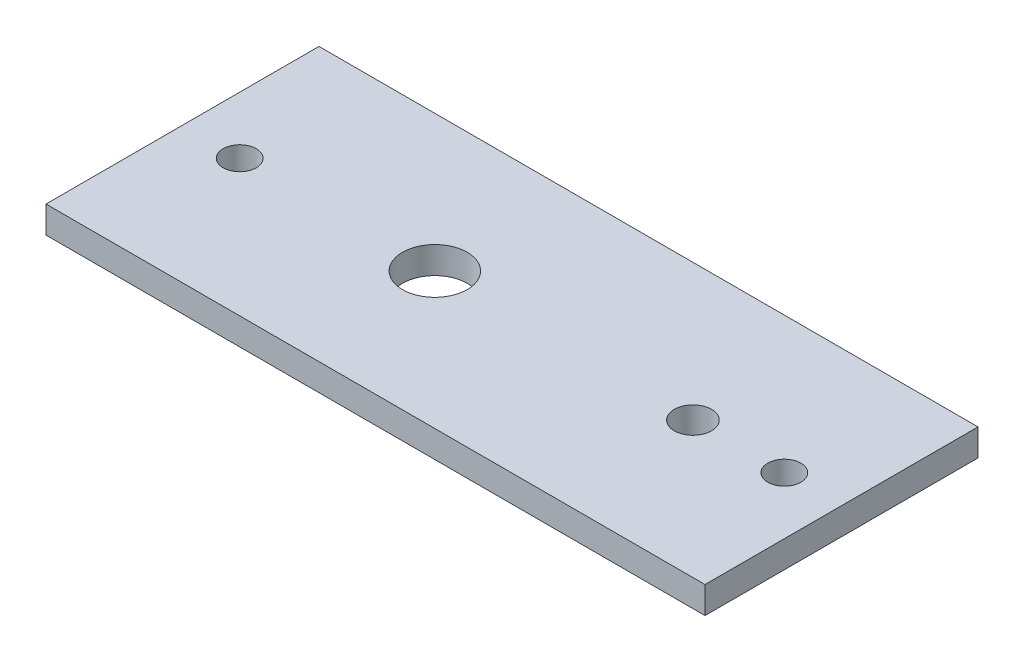
from build123d import *

# Parameters (mm, degrees)
SKETCH1_W           = 80.830931362
SKETCH1_H           = 33.48304161
SKETCH1_R           = 2.032
BOSS_EXTRUDE1_DEPTH = 3.302
SKETCH2_R           = 3.96875
SKETCH2_R_2         = 2.286
CUT_EXTRUDE1_DEPTH  = 3.302


with BuildPart() as part:
    # Sketch1 → Boss-Extrude1 (new body)
    with BuildSketch(Plane(origin=(0, 0, 0), x_dir=(1, 0, 0), z_dir=(0, 1, 0))):
        Rectangle(SKETCH1_W, SKETCH1_H)
        with Locations(Location((-33.401, 0, 0), (0, 0, 90))):
            Circle(SKETCH1_R, mode=Mode.SUBTRACT)
        with Locations(Location((33.401, 0, 0), (0, 0, 90))):
            Circle(SKETCH1_R, mode=Mode.SUBTRACT)
    extrude(amount=BOSS_EXTRUDE1_DEPTH)

    # Sketch2 → Cut-Extrude1 (cut)
    with BuildSketch(Plane.XZ):
        with Locations(Location((-9.4615, 0, 0), (0, 0, 270))):
            Circle(SKETCH2_R)
        with Locations(Location((22.209125, 0.016190079, 0), (0, 0, 270))):
            Circle(SKETCH2_R_2)
    extrude(amount=-CUT_EXTRUDE1_DEPTH, mode=Mode.SUBTRACT)


solid = part.part
